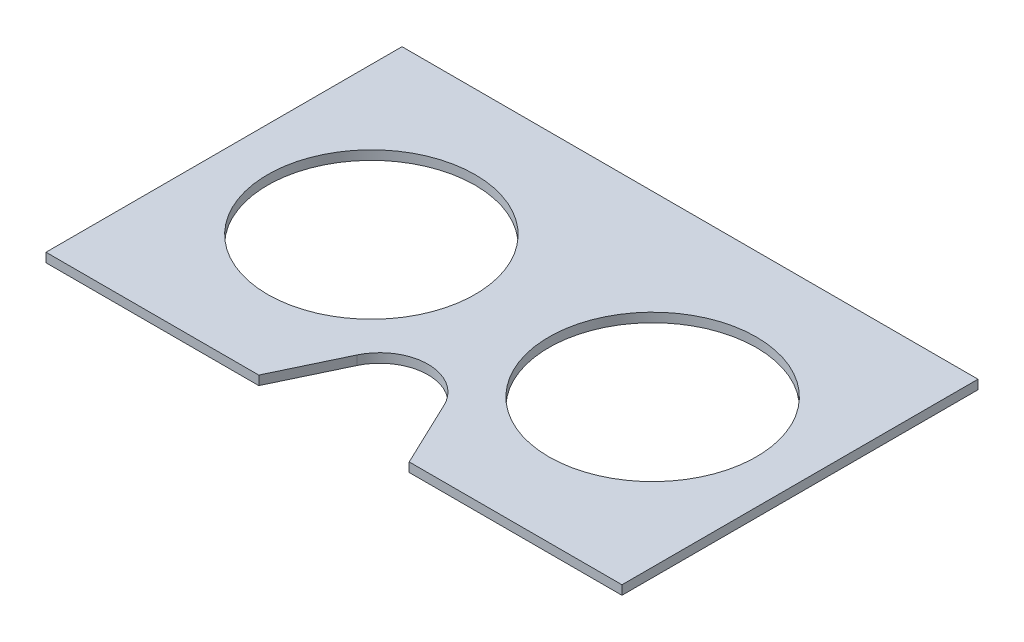
from build123d import *

# Parameters (mm, degrees)
SKETCH_1_R      = 22.65
EXTRUDE_1_DEPTH = 2


with BuildPart() as part:
    # 草图1 → 凸台-拉伸1 (new body)
    with BuildSketch(Plane(origin=(0, 0, 0), x_dir=(1, 0, 0), z_dir=(0, 1, 0))):
        with BuildLine():
            Line((0, -77.7), (46.435, -77.7))
            Line((46.435, -77.7), (53.35, -63.178332735))
            ThreePointArc((53.35, -63.178332735), (62.85, -57.18), (72.35, -63.178332735))
            Line((72.35, -63.178332735), (79.265, -77.7))
            Line((79.265, -77.7), (125.7, -77.7))
            Line((125.7, -77.7), (125.7, 0))
            Line((125.7, 0), (0, 0))
            Line((0, 0), (0, -77.7))
        make_face()
        with Locations(Location((32.16, -38.85, 0), (0, 0, 270))):
            Circle(SKETCH_1_R, mode=Mode.SUBTRACT)
        with Locations(Location((93.54, -38.85, 0), (0, 0, 270))):
            Circle(SKETCH_1_R, mode=Mode.SUBTRACT)
    extrude(amount=EXTRUDE_1_DEPTH)


solid = part.part
